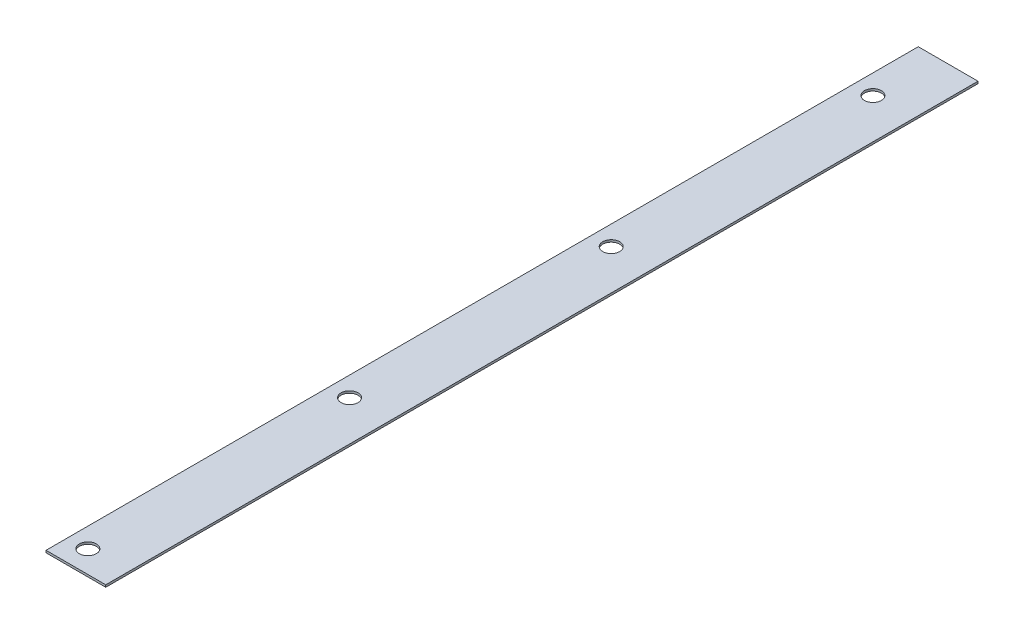
from build123d import *

# Parameters (mm, degrees)
ESQUISSE1_W             = 13.7
ESQUISSE1_H             = 0.5
BOSS_EXTRU_1_DEPTH      = 200
ENL_V_MAT_EXTRU_1_REACH = 202.469
ESQUISSE2_R             = 1.95


with BuildPart() as part:
    # Esquisse1 → Boss.-Extru.1 (new body)
    with BuildSketch(Plane.XY):
        with Locations((6.85, 0.25)):
            Rectangle(ESQUISSE1_W, ESQUISSE1_H)
    extrude(amount=BOSS_EXTRU_1_DEPTH)

    # Esquisse2 → Enlèv. mat.-Extru.1 (cut, up to next)
    with BuildSketch(Plane(origin=(0, 0.5, 0), x_dir=(1, 0, 0), z_dir=(0, 1, 0)), mode=Mode.PRIVATE) as enl_v_mat_extru_1_sk1:
        with Locations(Location((4.5, -14.9, 0), (0, 0, 270))):
            Circle(ESQUISSE2_R)
    enl_v_mat_extru_1_tool1 = extrude(enl_v_mat_extru_1_sk1.sketch, amount=-ENL_V_MAT_EXTRU_1_REACH, mode=Mode.PRIVATE) & part.part
    # Esquisse2 → Enlèv. mat.-Extru.1 (cut, up to next)
    with BuildSketch(Plane(origin=(0, 0.5, 0), x_dir=(1, 0, 0), z_dir=(0, 1, 0)), mode=Mode.PRIVATE) as enl_v_mat_extru_1_sk2:
        with Locations(Location((4.5, -74.9, 0), (0, 0, 270))):
            Circle(ESQUISSE2_R)
    enl_v_mat_extru_1_tool2 = extrude(enl_v_mat_extru_1_sk2.sketch, amount=-ENL_V_MAT_EXTRU_1_REACH, mode=Mode.PRIVATE) & part.part
    # Esquisse2 → Enlèv. mat.-Extru.1 (cut, up to next)
    with BuildSketch(Plane(origin=(0, 0.5, 0), x_dir=(1, 0, 0), z_dir=(0, 1, 0)), mode=Mode.PRIVATE) as enl_v_mat_extru_1_sk3:
        with Locations(Location((4.5, -134.9, 0), (0, 0, 270))):
            Circle(ESQUISSE2_R)
    enl_v_mat_extru_1_tool3 = extrude(enl_v_mat_extru_1_sk3.sketch, amount=-ENL_V_MAT_EXTRU_1_REACH, mode=Mode.PRIVATE) & part.part
    # Esquisse2 → Enlèv. mat.-Extru.1 (cut, up to next)
    with BuildSketch(Plane(origin=(0, 0.5, 0), x_dir=(1, 0, 0), z_dir=(0, 1, 0)), mode=Mode.PRIVATE) as enl_v_mat_extru_1_sk4:
        with Locations(Location((4.5, -194.9, 0), (0, 0, 270))):
            Circle(ESQUISSE2_R)
    enl_v_mat_extru_1_tool4 = extrude(enl_v_mat_extru_1_sk4.sketch, amount=-ENL_V_MAT_EXTRU_1_REACH, mode=Mode.PRIVATE) & part.part
    add(enl_v_mat_extru_1_tool1.solids().sort_by_distance((4.5, 0.5, 14.9))[0], mode=Mode.SUBTRACT)
    add(enl_v_mat_extru_1_tool2.solids().sort_by_distance((4.5, 0.5, 74.9))[0], mode=Mode.SUBTRACT)
    add(enl_v_mat_extru_1_tool3.solids().sort_by_distance((4.5, 0.5, 134.9))[0], mode=Mode.SUBTRACT)
    add(enl_v_mat_extru_1_tool4.solids().sort_by_distance((4.5, 0.5, 194.9))[0], mode=Mode.SUBTRACT)


solid = part.part
